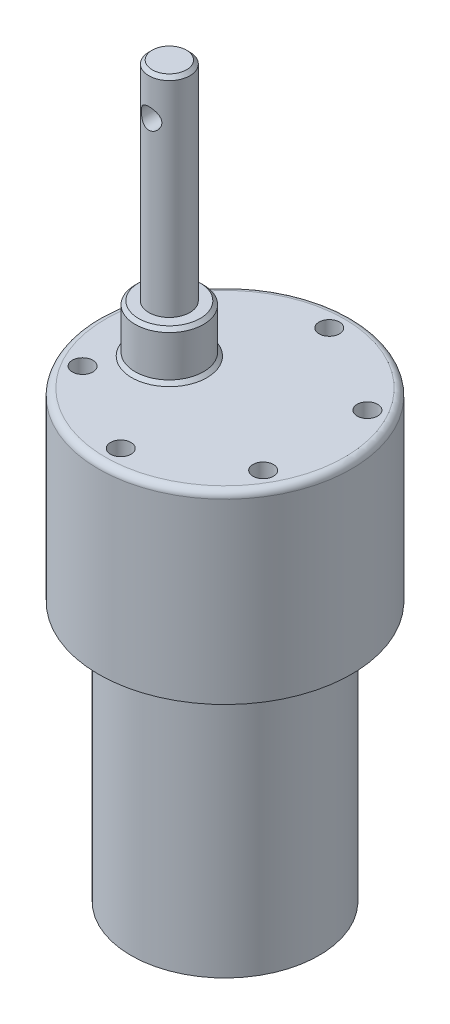
from build123d import *

# Parameters (mm, degrees)
SKETCH2_R               = 5
BOSS_EXTRUDE1_DEPTH     = 7
SKETCH3_R               = 3
BOSS_EXTRUDE2_DEPTH     = 30.5
SKETCH4_R               = 1.5
CUT_EXTRUDE1_DEPTH      = 3
CUT_EXTRUDE2_DEPTH      = 4
CUT_EXTRUDE2_DEPTH_BACK = 4
SKETCH5_R               = 1.5
CHAMFER1_SIZE           = 0.5
FILLET1_R               = 0.5
CHAMFER2_SIZE           = 0.5
CHAMFER3_SIZE           = 0.5
FILLET4_R               = 1


with BuildPart() as part:
    # Sketch1 → Revolve1 (revolve)
    with BuildSketch(Plane.XY):
        Polygon((0, 67), (18.5, 67), (18.5, 40), (13.75, 40), (13.75, 2), (4, 2), (4, 0), (0, 0), align=None)
    revolve(axis=Axis((0, 116.312873798, 0), (0, -1, 0)))

    # Sketch2 → Boss-Extrude1 (add)
    with BuildSketch(Plane(origin=(0, 67, 0), x_dir=(1, 0, 0), z_dir=(0, 1, 0))):
        with Locations((-8.140754401, 0)):
            Circle(SKETCH2_R)
    extrude(amount=BOSS_EXTRUDE1_DEPTH)

    # Sketch3 → Boss-Extrude2 (add)
    with BuildSketch(Plane(origin=(0, 74, 0), x_dir=(1, 0, 0), z_dir=(0, 1, 0))):
        with Locations((-8.140754401, 0)):
            Circle(SKETCH3_R)
    extrude(amount=BOSS_EXTRUDE2_DEPTH)

    # Sketch4 → Cut-Extrude1 (cut)
    with BuildSketch(Plane(origin=(0, 67, 0), x_dir=(1, 0, 0), z_dir=(0, 1, 0))):
        with Locations((0, 15.25)):
            Circle(SKETCH4_R)
        with Locations((13.206887408, 7.625)):
            Circle(SKETCH4_R)
        with Locations((13.206887408, -7.625)):
            Circle(SKETCH4_R)
        with Locations((0, -15.25)):
            Circle(SKETCH4_R)
        with Locations((-13.206887408, -7.625)):
            Circle(SKETCH4_R)
        with Locations((-13.206887408, 7.625)):
            Circle(SKETCH4_R)
    extrude(amount=-CUT_EXTRUDE1_DEPTH, mode=Mode.SUBTRACT)

    # Sketch5 → Cut-Extrude2 (cut, two sides: drawn at the far end of the back side and taken through both)
    with BuildSketch(Plane.XY.offset(-CUT_EXTRUDE2_DEPTH_BACK)):
        with Locations((-8.140754401, 98.6)):
            Circle(SKETCH5_R)
    extrude(amount=CUT_EXTRUDE2_DEPTH + CUT_EXTRUDE2_DEPTH_BACK, mode=Mode.SUBTRACT)

    # Chamfer1
    chamfer1_edges = [part.edges().sort_by_distance(p)[0] for p in [
        (-13.140754401, 67, 0),
        (-13.140754401, 74, 0),
    ]]
    chamfer(chamfer1_edges, length=CHAMFER1_SIZE)

    # Fillet1
    fillet1_edges = [part.edges().sort_by_distance(p)[0] for p in [
        (-4, 0, 0),
    ]]
    fillet(fillet1_edges, radius=FILLET1_R)

    # Chamfer2
    chamfer2_edges = [part.edges().sort_by_distance(p)[0] for p in [
        (-4, 2, 0),
    ]]
    chamfer(chamfer2_edges, length=CHAMFER2_SIZE)

    # Chamfer3
    chamfer3_edges = [part.edges().sort_by_distance(p)[0] for p in [
        (-11.140754401, 104.5, 0),
    ]]
    chamfer(chamfer3_edges, length=CHAMFER3_SIZE)

    # Fillet4
    fillet4_edges = [part.edges().sort_by_distance(p)[0] for p in [
        (-18.5, 67, 0),
    ]]
    fillet(fillet4_edges, radius=FILLET4_R)

    # Sketch6 → Cut-Revolve1 (revolve, cut)
    with BuildSketch(Plane.XY):
        with BuildLine():
            Line((13.769543402, 40), (12.269543402, 40))
            ThreePointArc((12.269543402, 40), (13.330203573, 39.560660172), (13.769543402, 38.5))
            Line((13.769543402, 38.5), (13.769543402, 40))
        make_face()
    revolve(axis=Axis((0, 116.312873798, 0), (0, -1, 0)), mode=Mode.SUBTRACT)


solid = part.part
